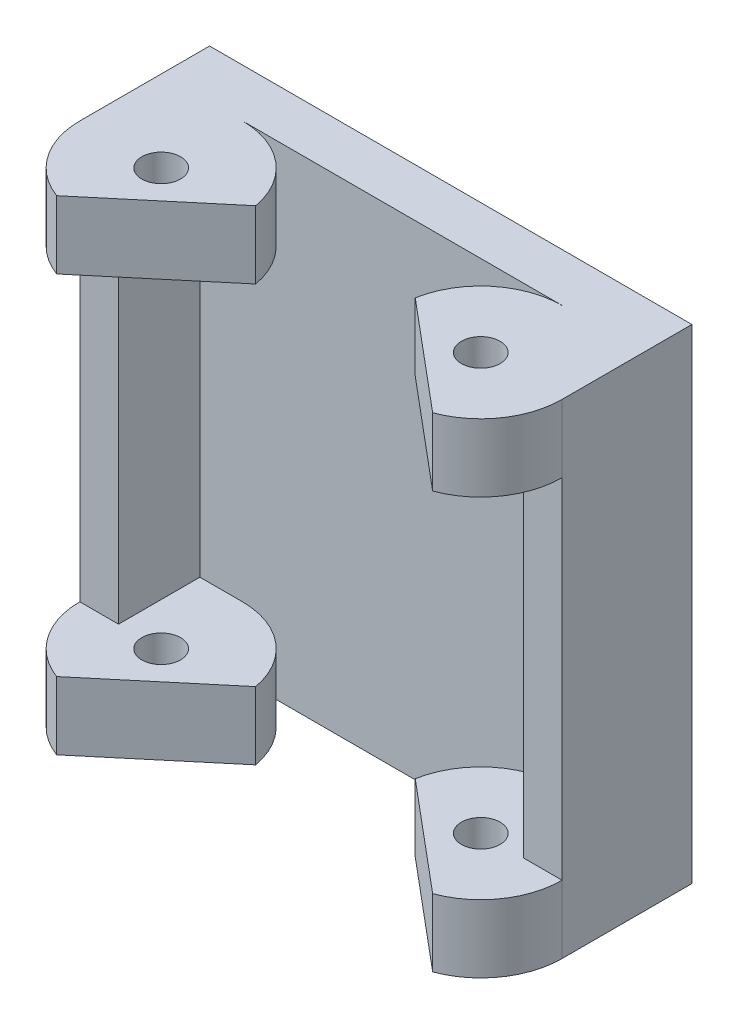
from build123d import *

# Parameters (mm, degrees)
BOSS_EXTRUDE2_DEPTH     = 7
CUT_EXTRUDE2_DEPTH      = 30.130224853
CUT_EXTRUDE2_DEPTH_BACK = 30.130224853
SKETCH3_R               = 2
BOSS_EXTRUDE3_DEPTH     = 36
SKETCH5_R               = 2
BOSS_EXTRUDE4_DEPTH     = 7


with BuildPart() as part:
    # Sketch1 → Boss-Extrude2 (new body)
    with BuildSketch(Plane(origin=(0, 0, 0), x_dir=(1, 0, 0), z_dir=(0, 1, 0))):
        with BuildLine():
            Line((-24.9, 0), (-24.9, 13.4))
            Line((-24.9, 13.4), (24.9, 13.4))
            Line((24.9, 13.4), (24.9, 0))
            ThreePointArc((24.9, 0), (23.392904185, -4.800819919), (19.412411454, -7.878950407))
            Line((19.412411454, -7.878950407), (8.235013612, 1.5))
            ThreePointArc((8.235013612, 1.5), (11.116692467, 6.448255578), (16.5, 8.4))
            Line((16.5, 8.4), (-16.5, 8.4))
            ThreePointArc((-16.5, 8.4), (-11.116692467, 6.448255578), (-8.235013612, 1.5))
            Line((-8.235013612, 1.5), (-19.412411454, -7.878950407))
            ThreePointArc((-19.412411454, -7.878950407), (-23.392904185, -4.800819919), (-24.9, 0))
        make_face()
    extrude(amount=BOSS_EXTRUDE2_DEPTH)

    # Sketch3 → Cut-Extrude2 (cut, two sides: drawn at the far end of the back side and taken through both)
    with BuildSketch(Plane(origin=(0, 7, 0), x_dir=(1, 0, 0), z_dir=(0, 1, 0)).offset(-CUT_EXTRUDE2_DEPTH_BACK)):
        with Locations(Location((-16.5, 0, 0), (0, 0, 270))):
            Circle(SKETCH3_R)
        with Locations(Location((16.5, 0, 0), (0, 0, 270))):
            Circle(SKETCH3_R)
    extrude(amount=CUT_EXTRUDE2_DEPTH + CUT_EXTRUDE2_DEPTH_BACK, mode=Mode.SUBTRACT)

    # Sketch4 → Boss-Extrude3 (add)
    with BuildSketch(Plane(origin=(0, 7, 0), x_dir=(1, 0, 0), z_dir=(0, 1, 0))):
        Polygon((-24.9, 13.4), (-24.9, 0), (-20.9, 0), (-20.9, 8.4), (-16.5, 8.4), (16.5, 8.4), (20.9, 8.4), (20.9, 0), (24.9, 0), (24.9, 13.4), align=None)
    extrude(amount=BOSS_EXTRUDE3_DEPTH)

    # Sketch5 → Boss-Extrude4 (add)
    with BuildSketch(Plane(origin=(0, 43, 0), x_dir=(1, 0, 0), z_dir=(0, 1, 0))):
        with BuildLine():
            Line((-24.9, 13.4), (-24.9, 0))
            ThreePointArc((-24.9, 0), (-23.392904185, -4.800819919), (-19.412411454, -7.878950407))
            Line((-19.412411454, -7.878950407), (-8.235013612, 1.5))
            ThreePointArc((-8.235013612, 1.5), (-11.116692467, 6.448255578), (-16.5, 8.4))
            Line((-16.5, 8.4), (16.5, 8.4))
            ThreePointArc((16.5, 8.4), (11.116692467, 6.448255578), (8.235013612, 1.5))
            Line((8.235013612, 1.5), (19.412411454, -7.878950407))
            ThreePointArc((19.412411454, -7.878950407), (23.392904185, -4.800819919), (24.9, 0))
            Line((24.9, 0), (24.9, 13.4))
            Line((24.9, 13.4), (-24.9, 13.4))
        make_face()
        with Locations(Location((16.5, 0, 0), (0, 0, 270))):
            Circle(SKETCH5_R, mode=Mode.SUBTRACT)
        with Locations(Location((-16.5, 0, 0), (0, 0, 270))):
            Circle(SKETCH5_R, mode=Mode.SUBTRACT)
    extrude(amount=BOSS_EXTRUDE4_DEPTH)


solid = part.part
